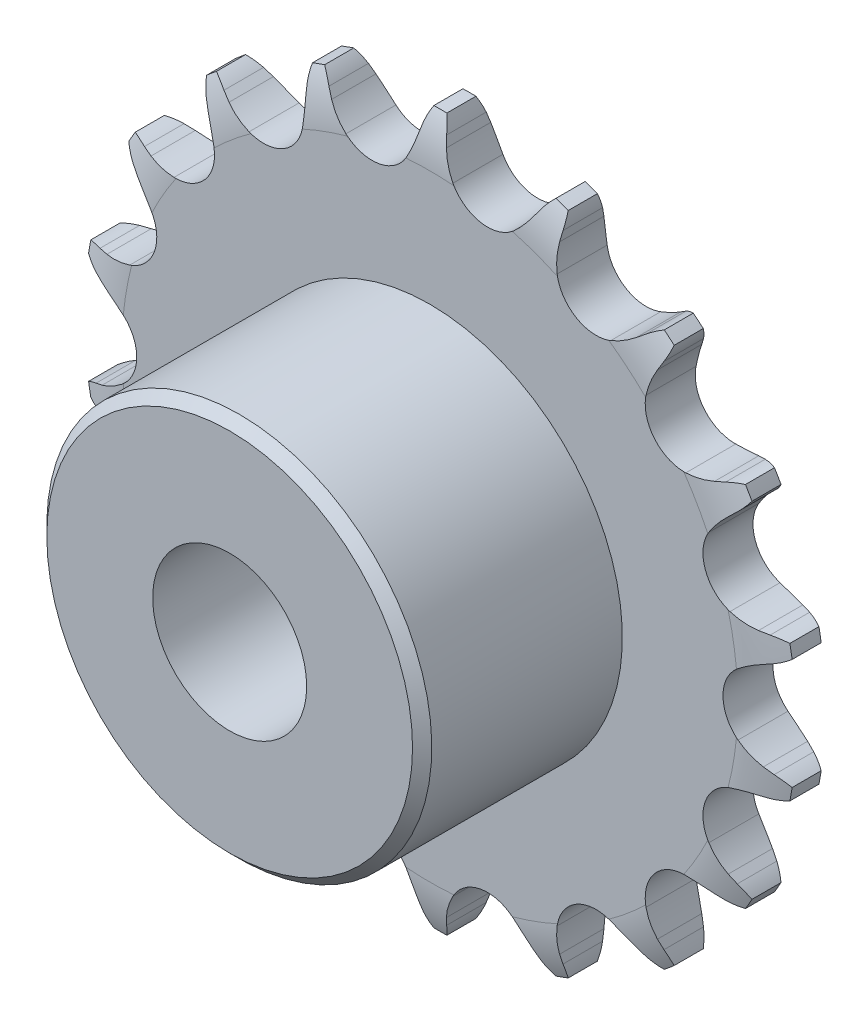
from build123d import *

# Parameters (mm, degrees)
CUT_EXTRUDE1_DEPTH      = 27.638535281
CIRPATTERN1_COUNT       = 18
BOSS_EXTRUDE1_START     = 1.3
SKETCH2_R               = 10
BOSS_EXTRUDE1_DEPTH     = 10.4
CUT_EXTRUDE2_DEPTH      = 29.898380991
CUT_EXTRUDE2_DEPTH_BACK = 29.898380991
SKETCH3_R               = 4
SKETCH4_W               = 1.95
SKETCH4_H               = 5.63753401
CUT_EXTRUDE3_DEPTH      = 29.898380991
CUT_EXTRUDE3_DEPTH_BACK = 29.898380991
SKETCH5_OUTSIDE_W       = 49.992
SKETCH5_OUTSIDE_H       = 50.512
SKETCH5_OUTSIDE_R       = 18.5


with BuildPart() as part:
    # Sketch1 → Revolve1 (revolve)
    with BuildSketch(Plane(origin=(0, 0, 0), x_dir=(0, 0, -1), z_dir=(1, 0, 0))):
        with BuildLine():
            Line((1.3, 0), (-1.3, 0))
            Line((-1.3, 0), (-1.3, 16.001373237))
            ThreePointArc((-1.3, 16.001373237), (-1.122370651, 17.450510911), (-0.6, 18.813845459))
            Line((-0.6, 18.813845459), (0.6, 18.813845459))
            ThreePointArc((0.6, 18.813845459), (1.122370651, 17.450510911), (1.3, 16.001373237))
            Line((1.3, 16.001373237), (1.3, 0))
        make_face()
    revolve(axis=Axis((0, 0, -1.3), (0, 0, 1)))

    # Sketch0 → Cut-Extrude1 (cut, symmetric)
    with BuildSketch(Plane.XY):
        with BuildLine():
            Line((5.516200851, -16.912295204), (5.251775998, -16.511949951))
            ThreePointArc((5.251775998, -16.511949951), (4.840114103, -15.968949749), (4.361568412, -15.48386341))
            ThreePointArc((4.361568412, -15.48386341), (2.644351167, -14.9968607), (1.197259531, -16.041816442))
            ThreePointArc((1.197259531, -16.041816442), (0.913482976, -16.661320761), (0.712364338, -17.312370703))
            Line((0.712364338, -17.312370703), (0.600812395, -17.77901081))
            ThreePointArc((0.600812395, -17.77901081), (-0.762863809, -19.744341498), (-3.097148306, -20.267077938))
            ThreePointArc((-3.097148306, -20.267077938), (3.560197495, -20.190883328), (9.84211631, -17.985536476))
            ThreePointArc((9.84211631, -17.985536476), (7.469820001, -18.292697218), (5.516200851, -16.912295204))
        make_face()
    cut_extrude1 = extrude(amount=CUT_EXTRUDE1_DEPTH, both=True, mode=Mode.SUBTRACT)

    # CirPattern1: Cut-Extrude1 ×18 about axis
    cirpattern1_axis = Axis((0, 0, 0), (0, 0, 1))
    for i in range(1, CIRPATTERN1_COUNT):
        add(cut_extrude1.rotate(cirpattern1_axis, i * 360 / CIRPATTERN1_COUNT), mode=Mode.SUBTRACT)

    # Sketch2 → Boss-Extrude1 (add)
    with BuildSketch(Plane.XY.offset(BOSS_EXTRUDE1_START)):
        with Locations(Location((0, 0, 0), (0, 0, 270))):
            Circle(SKETCH2_R)
    extrude(amount=BOSS_EXTRUDE1_DEPTH)

    # Sketch3 → Cut-Extrude2 (cut, two sides: drawn at the far end of the back side and taken through both)
    with BuildSketch(Plane.XY.offset(-CUT_EXTRUDE2_DEPTH_BACK)):
        Circle(SKETCH3_R)
    extrude(amount=CUT_EXTRUDE2_DEPTH + CUT_EXTRUDE2_DEPTH_BACK, mode=Mode.SUBTRACT)

    # Sketch4 → Cut-Revolve1 (revolve, cut)
    with BuildSketch(Plane(origin=(0, 0, 0), x_dir=(0, 0, -1), z_dir=(1, 0, 0))):
        Polygon((-11.7, 10), (-11.7, 9.5), (-11.2, 10), align=None)
        with Locations((-2.275, 15.995078454)):
            Rectangle(SKETCH4_W, SKETCH4_H)
    revolve(axis=Axis((0, 0, -1.3), (0, 0, 1)), mode=Mode.SUBTRACT)

    # Sketch5 outside → Cut-Extrude3 (cut, two sides: drawn at the far end of the back side and taken through both)
    with BuildSketch(Plane.XY.offset(-CUT_EXTRUDE3_DEPTH_BACK)):
        Rectangle(SKETCH5_OUTSIDE_W, SKETCH5_OUTSIDE_H)
        Circle(SKETCH5_OUTSIDE_R, mode=Mode.SUBTRACT)
    extrude(amount=CUT_EXTRUDE3_DEPTH + CUT_EXTRUDE3_DEPTH_BACK, mode=Mode.SUBTRACT)


solid = part.part
